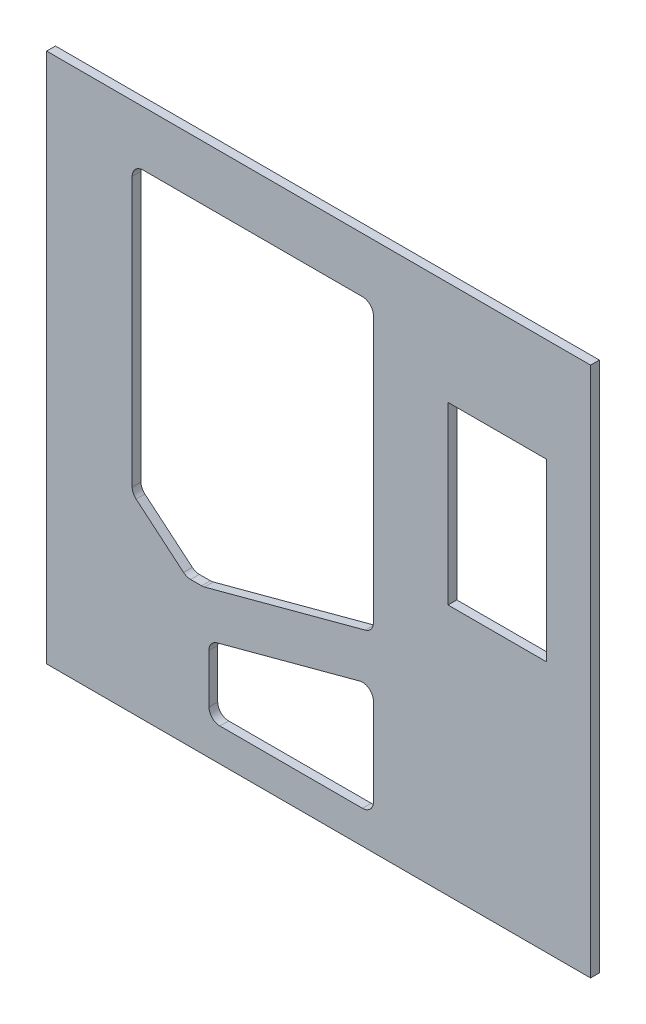
from build123d import *

# Parameters (mm, degrees)
SKETCH1_W           = 496
SKETCH1_H           = 484
BOSS_EXTRUDE1_DEPTH = 8
SKETCH2_W           = 220
SKETCH2_H           = 260
CUT_EXTRUDE1_DEPTH  = 347.600634737
CUT_EXTRUDE2_DEPTH  = 347.600634737
FILLET1_R           = 10
FILLET2_R           = 10
CUT_EXTRUDE3_REACH  = 348.601
SKETCH4_W           = 90
SKETCH4_H           = 160


with BuildPart() as part:
    # Sketch1 → Boss-Extrude1 (new body)
    with BuildSketch(Plane.XY):
        Rectangle(SKETCH1_W, SKETCH1_H)
    extrude(amount=BOSS_EXTRUDE1_DEPTH)

    # Sketch2 → Cut-Extrude1 (cut, through all)
    with BuildSketch(Plane.XY.offset(8)):
        with Locations((-60, 62)):
            Rectangle(SKETCH2_W, SKETCH2_H)
        Polygon((-120.381967555, -109.634472725), (-170, -68), (50, -68), (-105.381967555, -109.634472725), align=None)
    extrude(amount=-CUT_EXTRUDE1_DEPTH, mode=Mode.SUBTRACT)

    # Sketch3 → Cut-Extrude2 (cut, through all)
    with BuildSketch(Plane.XY.offset(8)):
        Polygon((50, -109.411047216), (50, -212), (-100, -212), (-100, -149.603426081), align=None)
    extrude(amount=-CUT_EXTRUDE2_DEPTH, mode=Mode.SUBTRACT)

    # Fillet1
    fillet1_edges = [part.edges().sort_by_distance(p)[0] for p in [
        (50, -212, 4),
        (-100, -212, 4),
        (-100, -149.603426081, 4),
        (50, -109.411047216, 4),
    ]]
    fillet(fillet1_edges, radius=FILLET1_R)

    # Fillet2
    fillet2_edges = [part.edges().sort_by_distance(p)[0] for p in [
        (-170, -68, 4),
        (-170, 192, 4),
        (50, 192, 4),
        (50, -68, 4),
        (-105.381967555, -109.634472725, 4),
        (-120.381967555, -109.634472725, 4),
    ]]
    fillet(fillet2_edges, radius=FILLET2_R)

    # Sketch4 → Cut-Extrude3 (cut, up to next)
    with BuildSketch(Plane.XY.offset(8), mode=Mode.PRIVATE) as cut_extrude3_sk1:
        with Locations((163, 67.567761437)):
            Rectangle(SKETCH4_W, SKETCH4_H)
    cut_extrude3_tool1 = extrude(cut_extrude3_sk1.sketch, amount=-CUT_EXTRUDE3_REACH, mode=Mode.PRIVATE) & part.part
    add(cut_extrude3_tool1.solids().sort_by_distance((163, 67.567761, 8))[0], mode=Mode.SUBTRACT)


solid = part.part
